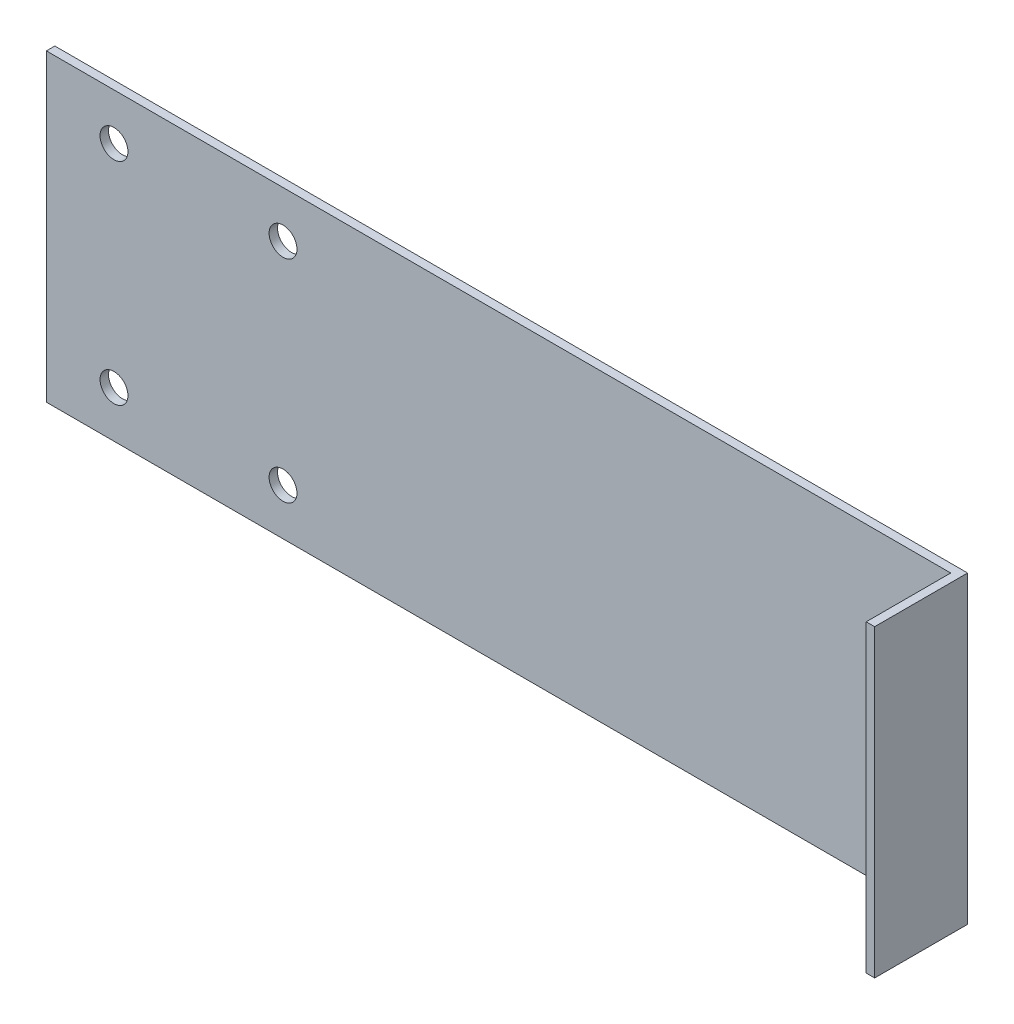
from build123d import *

# Parameters (mm, degrees)
SKETCH_1_W                  = 108
SKETCH_1_H                  = 36
EXTRUDE_1_DEPTH             = 1
HOLE_WIZARD_M4_1_AT_2_COUNT = 2
HOLE_WIZARD_M4_1_AT_2_PITCH = 20
SKETCH_4_W                  = 1
SKETCH_4_H                  = 36
EXTRUDE_2_DEPTH             = 10


with BuildPart() as part:
    # 草图1 → 凸台-拉伸1 (new body)
    with BuildSketch(Plane.XY):
        Rectangle(SKETCH_1_W, SKETCH_1_H)
    extrude(amount=EXTRUDE_1_DEPTH)

    # 草图3 → M4 螺纹孔的螺纹孔钻头1 (revolve, cut)
    with BuildSketch(Plane(origin=(-46, -12.5, 1), x_dir=(0, -1, 0), z_dir=(1, 0, 0))):
        Polygon((0, 0), (0, 10.991420021), (1.65, 10), (1.65, 0), align=None)
    hole_wizard_m4_1 = revolve(axis=Axis((-46, -12.5, 7.35), (0, 0, -1)), mode=Mode.SUBTRACT)

    # M4 螺纹孔的螺纹孔钻头1 at 2: M4 螺纹孔的螺纹孔钻头1 ×2
    with Locations(*[(i * HOLE_WIZARD_M4_1_AT_2_PITCH, 0, 0) for i in range(1, HOLE_WIZARD_M4_1_AT_2_COUNT)]):
        add(hole_wizard_m4_1, mode=Mode.SUBTRACT)

    # 镜向1: M4 螺纹孔的螺纹孔钻头1 across plane
    add(hole_wizard_m4_1.mirror(Plane.ZX), mode=Mode.SUBTRACT)

    # 镜向1 copy 1 sketch → 镜向1 copy 1 (revolve, cut)
    with BuildSketch(Plane(origin=(-26, 12.5, 1), x_dir=(0, 1, 0), z_dir=(1, 0, 0))):
        Polygon((0, 0), (0, -10.991420021), (1.65, -10), (1.65, 0), align=None)
    revolve(axis=Axis((-26, 12.5, 7.35), (0, 0, 1)), mode=Mode.SUBTRACT)

    # 草图4 → 凸台-拉伸2 (add)
    with BuildSketch(Plane.XY.offset(1)):
        with Locations((53.5, 0)):
            Rectangle(SKETCH_4_W, SKETCH_4_H)
    extrude(amount=EXTRUDE_2_DEPTH)


solid = part.part
